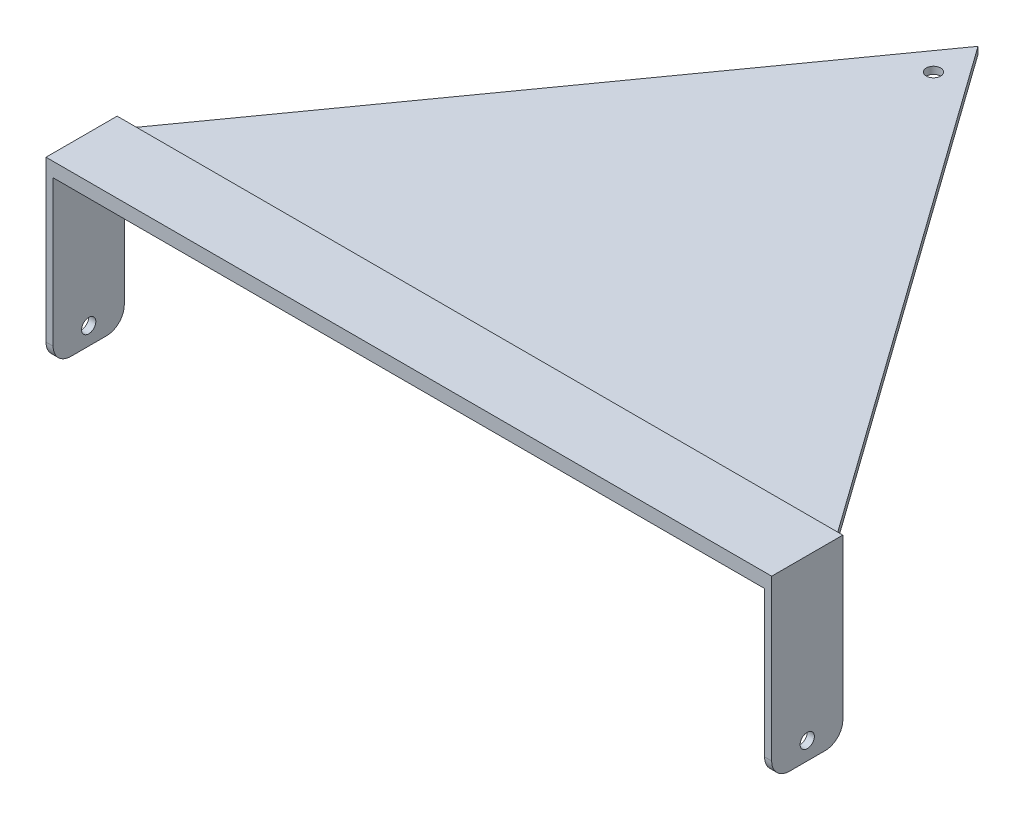
from build123d import *

# Parameters (mm, degrees)
SKETCH2_R           = 2
BOSS_EXTRUDE1_DEPTH = 2
SKETCH4_W           = 200
SKETCH4_H           = 20
BOSS_EXTRUDE4_DEPTH = 2
SKETCH7_W           = 2
SKETCH7_H           = 20
BOSS_EXTRUDE5_DEPTH = 50
FILLET1_R           = 5
SKETCH9_R           = 2
CUT_EXTRUDE1_DEPTH  = 250


with BuildPart() as part:
    # Sketch2 → Boss-Extrude1 (new body)
    with BuildSketch(Plane(origin=(0, 0, 0), x_dir=(1, 0, 0), z_dir=(0, 1, 0))):
        Polygon((200, 0), (200, 10), (100, 150), (0, 10), (0, 0), (0, -10), (200, -10), align=None)
        with Locations(Location((100, 137.477270849, 0), (0, 0, 270))):
            Circle(SKETCH2_R, mode=Mode.SUBTRACT)
    extrude(amount=BOSS_EXTRUDE1_DEPTH)

    # Sketch4 → Boss-Extrude4 (add)
    with BuildSketch(Plane(origin=(0, 2, 0), x_dir=(1, 0, 0), z_dir=(0, 1, 0))):
        with Locations((100, 0)):
            Rectangle(SKETCH4_W, SKETCH4_H)
    extrude(amount=BOSS_EXTRUDE4_DEPTH)

    # Sketch7 → Boss-Extrude5 (add)
    with BuildSketch(Plane(origin=(0, 4, 0), x_dir=(1, 0, 0), z_dir=(0, 1, 0))):
        with Locations((-1, 0)):
            Rectangle(SKETCH7_W, SKETCH7_H)
        with Locations((201, 0)):
            Rectangle(SKETCH7_W, SKETCH7_H)
    extrude(amount=-BOSS_EXTRUDE5_DEPTH)

    # Fillet1
    fillet1_edges = [part.edges().sort_by_distance(p)[0] for p in [
        (-1, -46, 10),
        (-1, -46, -10),
        (201, -46, -10),
        (201, -46, 10),
    ]]
    fillet(fillet1_edges, radius=FILLET1_R)

    # Sketch9 → Cut-Extrude1 (cut)
    with BuildSketch(Plane.ZY.offset(2)):
        with Locations((0, -41)):
            Circle(SKETCH9_R)
    extrude(amount=-CUT_EXTRUDE1_DEPTH, mode=Mode.SUBTRACT)


solid = part.part
